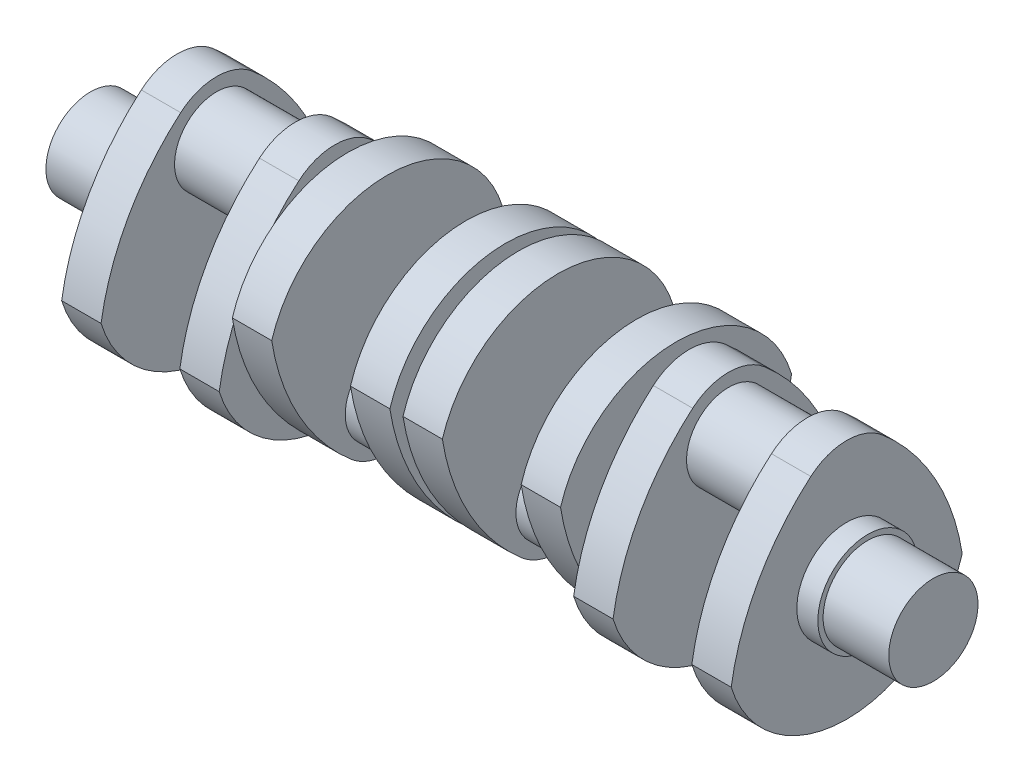
from build123d import *

# Parameters (mm, degrees)
SKETCH1_R           = 17
BOSS_EXTRUDE1_DEPTH = 25
SKETCH1_3_R         = 19
BOSS_EXTRUDE2_DEPTH = 8
BOSS_EXTRUDE3_DEPTH = 15
SKETCH3_R           = 16
BOSS_EXTRUDE4_DEPTH = 15
BOSS_EXTRUDE5_START = 5
SKETCH4_R           = 17
BOSS_EXTRUDE5_DEPTH = 5
BOSS_EXTRUDE6_DEPTH = 15
SKETCH6_R           = 16
BOSS_EXTRUDE7_DEPTH = 30
BOSS_EXTRUDE8_DEPTH = 15
BOSS_EXTRUDE9_START = 2.5
SKETCH8_R           = 17
BOSS_EXTRUDE9_DEPTH = 2.5


with BuildPart() as part:
    # Sketch1 → Boss-Extrude1 (new body)
    with BuildSketch(Plane(origin=(0, 0, 0), x_dir=(0, 0, -1), z_dir=(1, 0, 0))):
        Circle(SKETCH1_R)
    extrude(amount=-BOSS_EXTRUDE1_DEPTH)

    # Sketch1<3> → Boss-Extrude2 (add)
    with BuildSketch(Plane(origin=(0, 0, 0), x_dir=(0, 0, -1), z_dir=(1, 0, 0))):
        Circle(SKETCH1_3_R)
    extrude(amount=BOSS_EXTRUDE2_DEPTH)

    # Sketch2 → Boss-Extrude3 (add)
    with BuildSketch(Plane(origin=(8, 0, 0), x_dir=(0, 0, -1), z_dir=(1, 0, 0))):
        with BuildLine():
            ThreePointArc((-13.668094758, 40.943123461), (0, 46), (13.668094758, 40.943123461))
            ThreePointArc((13.668094758, 40.943123461), (33.683444249, 16.469257624), (44, -13.416407865))
            ThreePointArc((44, -13.416407865), (0, -46), (-44, -13.416407865))
            ThreePointArc((-44, -13.416407865), (-33.683444249, 16.469257624), (-13.668094758, 40.943123461))
        make_face()
    boss_extrude3 = extrude(amount=BOSS_EXTRUDE3_DEPTH)

    # Sketch3 → Boss-Extrude4 (add)
    with BuildSketch(Plane(origin=(23, 0, 0), x_dir=(0, 0, -1), z_dir=(1, 0, 0))):
        with Locations((0, 25)):
            Circle(SKETCH3_R)
    boss_extrude4 = extrude(amount=BOSS_EXTRUDE4_DEPTH)

    # Mirror1: Boss-Extrude3, Boss-Extrude4 across plane
    add(boss_extrude3.mirror(Plane(origin=(38, 25, 0), x_dir=(0, 0, 1), z_dir=(1, 0, 0))))
    add(boss_extrude4.mirror(Plane(origin=(38, 25, 0), x_dir=(0, 0, 1), z_dir=(1, 0, 0))))

    # Sketch4 → Boss-Extrude5 (add)
    with BuildSketch(Plane(origin=(68, 0, 0), x_dir=(0, 0, -1), z_dir=(1, 0, 0)).offset(BOSS_EXTRUDE5_START)):
        Circle(SKETCH4_R)
    extrude(amount=-BOSS_EXTRUDE5_DEPTH)

    # Sketch5 → Boss-Extrude6 (add)
    with BuildSketch(Plane(origin=(73, 0, 0), x_dir=(0, 0, -1), z_dir=(1, 0, 0))):
        with BuildLine():
            ThreePointArc((-13.668094758, -40.943123461), (0, -46), (13.668094758, -40.943123461))
            ThreePointArc((13.668094758, -40.943123461), (33.683444249, -16.469257624), (44, 13.416407865))
            ThreePointArc((44, 13.416407865), (0, 46), (-44, 13.416407865))
            ThreePointArc((-44, 13.416407865), (-33.683444249, -16.469257624), (-13.668094758, -40.943123461))
        make_face()
    extrude(amount=BOSS_EXTRUDE6_DEPTH)

    # Sketch6 → Boss-Extrude7 (add)
    with BuildSketch(Plane(origin=(88, 0, 0), x_dir=(0, 0, -1), z_dir=(1, 0, 0))):
        with Locations((0, -25)):
            Circle(SKETCH6_R)
    extrude(amount=BOSS_EXTRUDE7_DEPTH)

    # Sketch7 → Boss-Extrude8 (add)
    with BuildSketch(Plane(origin=(118, 0, 0), x_dir=(0, 0, -1), z_dir=(1, 0, 0))):
        with BuildLine():
            ThreePointArc((-13.668094758, -40.943123461), (0, -46), (13.668094758, -40.943123461))
            ThreePointArc((13.668094758, -40.943123461), (33.683444249, -16.469257624), (44, 13.416407865))
            ThreePointArc((44, 13.416407865), (0, 46), (-44, 13.416407865))
            ThreePointArc((-44, 13.416407865), (-33.683444249, -16.469257624), (-13.668094758, -40.943123461))
        make_face()
    extrude(amount=BOSS_EXTRUDE8_DEPTH)

    # Sketch8 → Boss-Extrude9 (add)
    with BuildSketch(Plane(origin=(133, 0, 0), x_dir=(0, 0, -1), z_dir=(1, 0, 0)).offset(BOSS_EXTRUDE9_START)):
        Circle(SKETCH8_R)
    extrude(amount=-BOSS_EXTRUDE9_DEPTH)

    # Mirror2: part across plane


with BuildPart() as part_1:
    add(part.part)
    add(part.part.mirror(Plane(origin=(135.5, 0, 0), x_dir=(0, 0, 1), z_dir=(1, 0, 0))))


solid = part_1.part
